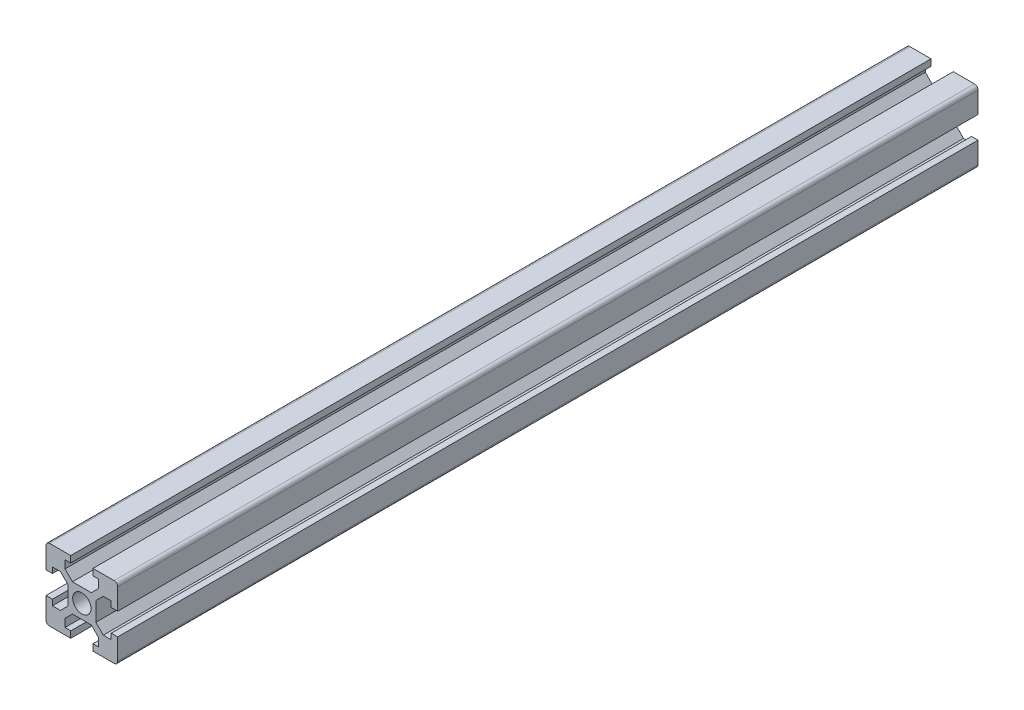
from build123d import *

# Parameters (mm, degrees)
SKETCH_1_R      = 2.55
EXTRUDE_1_DEPTH = 240
FILLET_1_R      = 1


with BuildPart() as part:
    # 草图1 → 凸台-拉伸1 (new body)
    with BuildSketch(Plane.XY):
        Polygon((4.62194142, 1.905266374), (6.694733626, 3.97805858), (6.694733626, 6.205266374), (5.094733626, 6.205266374), (5.094733626, 8.005266374), (11.994733626, 8.005266374), (11.994733626, 1.105266374), (10.194733626, 1.105266374), (10.194733626, 2.705266374), (7.967525833, 2.705266374), (5.894733626, 0.632474167), (5.894733626, -4.62194142), (7.967525833, -6.694733626), (10.194733626, -6.694733626), (10.194733626, -5.094733626), (11.994733626, -5.094733626), (11.994733626, -11.994733626), (5.094733626, -11.994733626), (5.094733626, -10.194733626), (6.694733626, -10.194733626), (6.694733626, -7.967525833), (4.62194142, -5.894733626), (-0.632474167, -5.894733626), (-2.705266374, -7.967525833), (-2.705266374, -10.194733626), (-1.105266374, -10.194733626), (-1.105266374, -11.994733626), (-8.005266374, -11.994733626), (-8.005266374, -5.094733626), (-6.205266374, -5.094733626), (-6.205266374, -6.694733626), (-3.97805858, -6.694733626), (-1.905266374, -4.62194142), (-1.905266374, 0.632474167), (-3.97805858, 2.705266374), (-6.205266374, 2.705266374), (-6.205266374, 1.105266374), (-8.005266374, 1.105266374), (-8.005266374, 8.005266374), (-1.105266374, 8.005266374), (-1.105266374, 6.205266374), (-2.705266374, 6.205266374), (-2.705266374, 3.97805858), (-0.632474167, 1.905266374), align=None)
        with Locations((1.994733626, -1.994733626)):
            Circle(SKETCH_1_R, mode=Mode.SUBTRACT)
    extrude(amount=EXTRUDE_1_DEPTH)

    # 圆角1
    fillet_1_edges = [part.edges().sort_by_distance(p)[0] for p in [
        (-8.005266374, -11.994733626, 120),
        (-8.005266374, 8.005266374, 120),
        (11.994733626, 8.005266374, 120),
        (11.994733626, -11.994733626, 120),
    ]]
    fillet(fillet_1_edges, radius=FILLET_1_R)


solid = part.part
